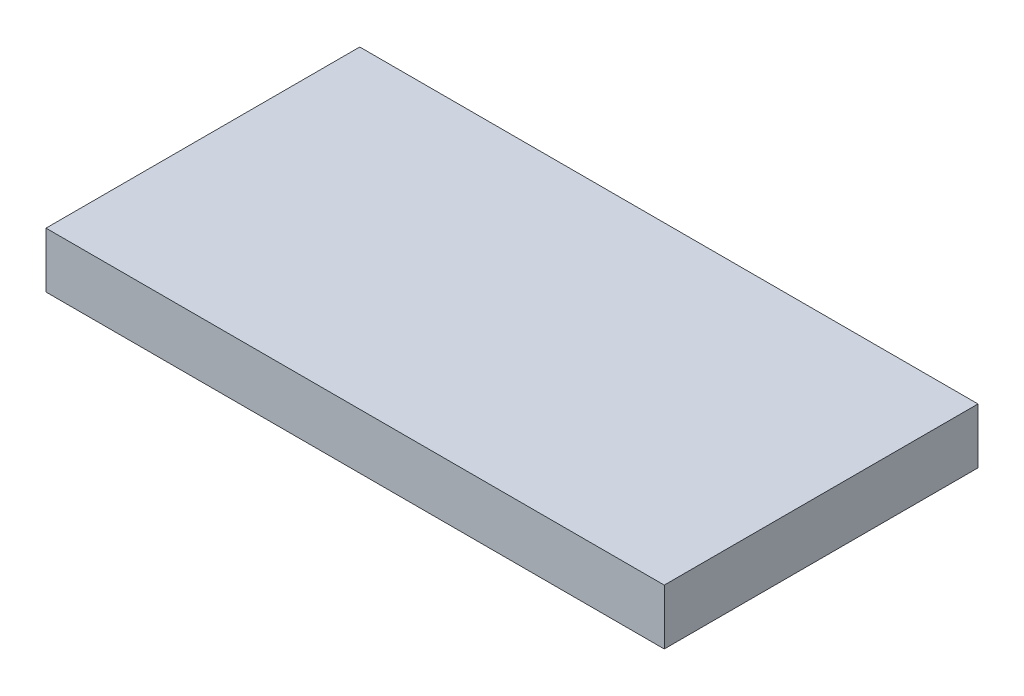
from build123d import *

# Parameters (mm, degrees)
SKETCH1_W           = 67
SKETCH1_H           = 34
BOSS_EXTRUDE1_DEPTH = 6


with BuildPart() as part:
    # Sketch1 → Boss-Extrude1 (new body)
    with BuildSketch(Plane(origin=(0, 0, 0), x_dir=(1, 0, 0), z_dir=(0, 1, 0))):
        with Locations((33.5, 17)):
            Rectangle(SKETCH1_W, SKETCH1_H)
    extrude(amount=BOSS_EXTRUDE1_DEPTH)


solid = part.part
